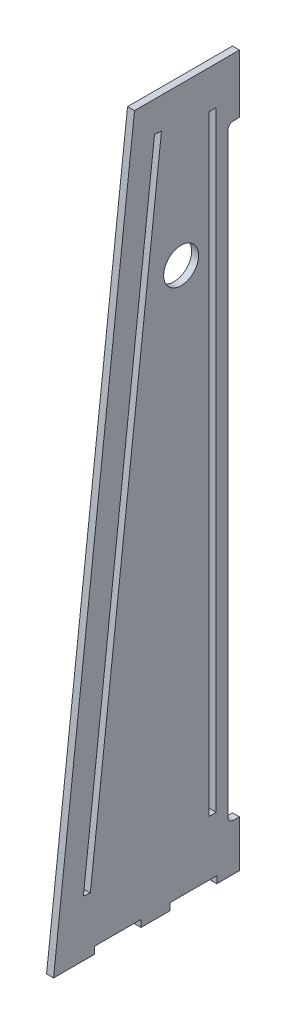
from build123d import *

# Parameters (mm, degrees)
SKETCH1_R           = 15
SKETCH1_W           = 523.453034516
SKETCH1_H           = 6
BOSS_EXTRUDE1_DEPTH = 6


with BuildPart() as part:
    # Sketch1 → Boss-Extrude1 (new body)
    with BuildSketch(Plane.YZ):
        with BuildLine():
            Line((-165.811435327, 45.958456005), (-165.811435327, 10.958456005))
            Line((-165.811435327, 10.958456005), (-159.811435327, 10.958456005))
            Line((-159.811435327, 10.958456005), (-159.811435327, -29.041543995))
            Line((-159.811435327, -29.041543995), (-165.811435327, -29.041543995))
            Line((-165.811435327, -29.041543995), (-165.811435327, -54.041543995))
            Line((-165.811435327, -54.041543995), (-159.811435327, -54.041543995))
            Line((-159.811435327, -54.041543995), (-159.811435327, -94.041543995))
            Line((-159.811435327, -94.041543995), (-165.811435327, -94.041543995))
            Line((-165.811435327, -94.041543995), (-165.811435327, -113.496690816))
            Line((-165.811435327, -113.496690816), (-125.811435327, -113.496690816))
            Line((-125.811435327, -113.496690816), (-125.811435327, -108.496690816))
            ThreePointArc((-125.811435327, -108.496690816), (-124.346969233, -104.96115691), (-120.811435327, -103.496690816))
            Line((-120.811435327, -103.496690816), (388.788564673, -103.496690816))
            ThreePointArc((388.788564673, -103.496690816), (392.324098579, -104.96115691), (393.788564673, -108.496690816))
            Line((393.788564673, -108.496690816), (393.788564673, -113.496690816))
            Line((393.788564673, -113.496690816), (443.788564673, -113.496690816))
            Line((443.788564673, -113.496690816), (443.788564673, -23.496690816))
            Line((443.788564673, -23.496690816), (-165.811435327, 45.958456005))
        make_face()
        with Locations(Location((308.788564673, -63.496690816, 0), (0, 0, 270))):
            Circle(SKETCH1_R, mode=Mode.SUBTRACT)
        Polygon((-117.76145538, 20.354457657), (-118.440674663, 14.393026523), (416.988579422, -46.611431244), (417.667798704, -40.65000011), align=None, mode=Mode.SUBTRACT)
        with Locations((149.276829124, -90.496690816)):
            Rectangle(SKETCH1_W, SKETCH1_H, mode=Mode.SUBTRACT)
    extrude(amount=BOSS_EXTRUDE1_DEPTH)


solid = part.part
